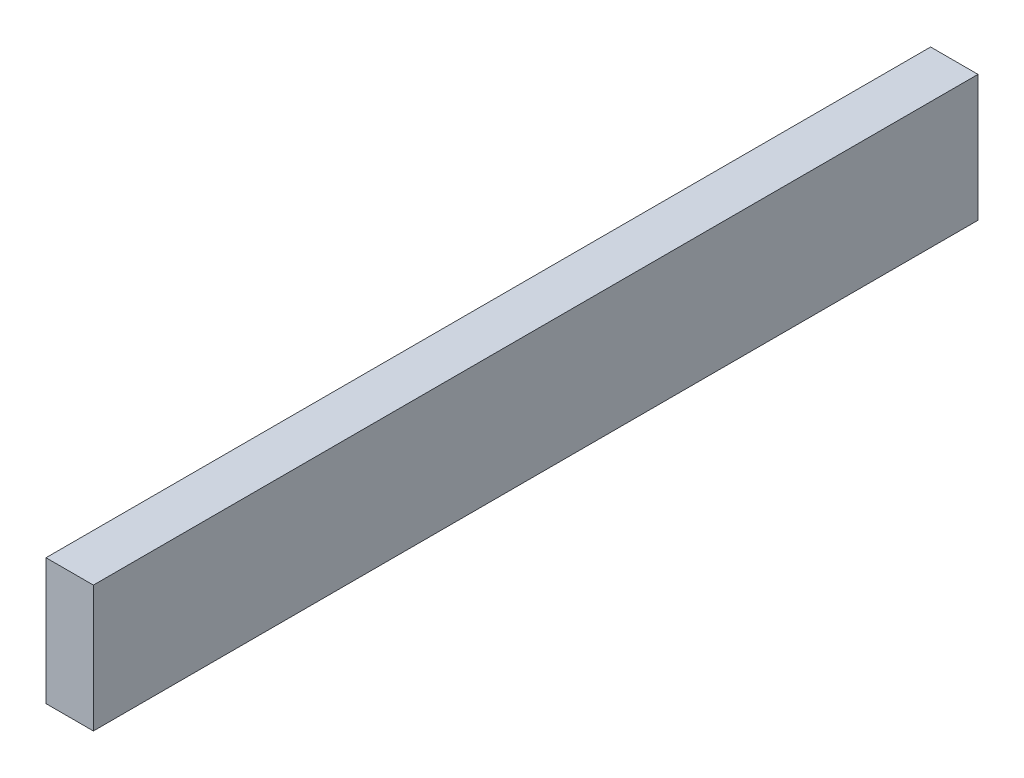
from build123d import *

# Parameters (mm, degrees)
SKETCH1_W           = 19.05
SKETCH1_H           = 355.6
BOSS_EXTRUDE1_DEPTH = 50.8


with BuildPart() as part:
    # Sketch1 → Boss-Extrude1 (new body)
    with BuildSketch(Plane(origin=(0, 0, 0), x_dir=(1, 0, 0), z_dir=(0, 1, 0))):
        Rectangle(SKETCH1_W, SKETCH1_H)
    extrude(amount=-BOSS_EXTRUDE1_DEPTH)


solid = part.part
